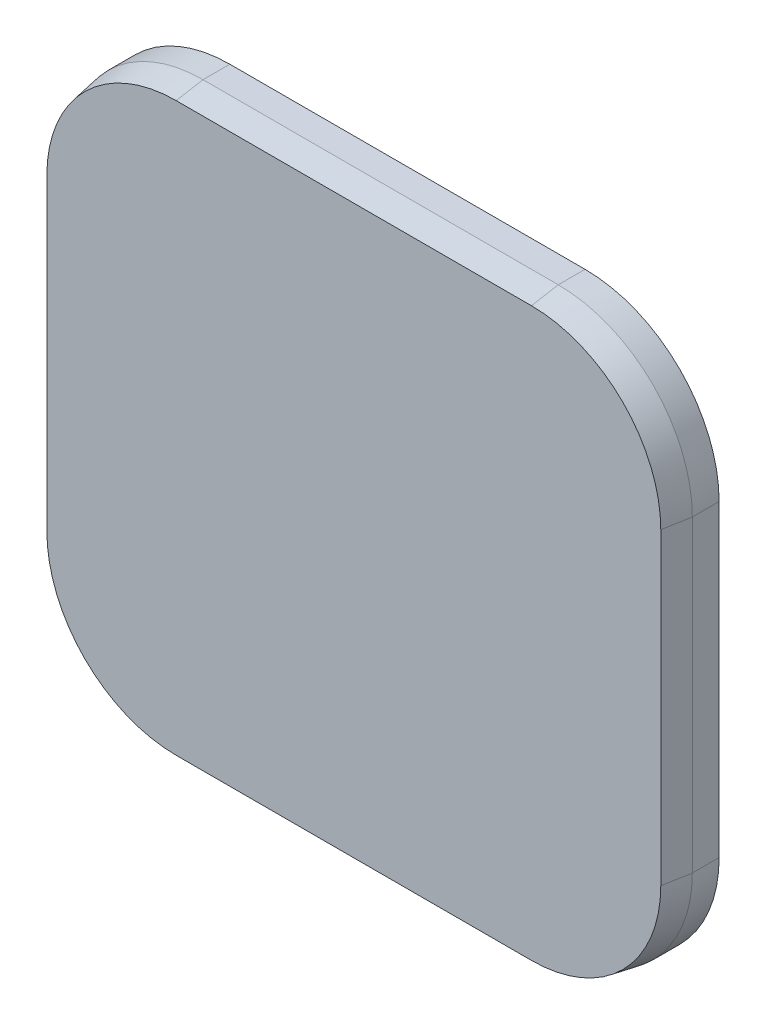
from build123d import *

# Parameters (mm, degrees)
RESSALTO_EXTRUS_O2_DEPTH           = 2
RESSALTO_EXTRUS_O2_OTHER_WAY_DEPTH = 2
RESSALTO_EXTRUS_O2_OTHER_WAY_TAPER = 10


with BuildPart() as part:
    # Esboço6 → Ressalto-extrusão2 (new body)
    with BuildSketch(Plane.XY):
        with BuildLine():
            ThreePointArc((-10, 0), (-2.928932188, 2.928932188), (0, 10))
            Line((0, 10), (0, 33))
            ThreePointArc((0, 33), (-2.928932188, 40.071067812), (-10, 43))
            Line((-10, 43), (-36.5, 43))
            ThreePointArc((-36.5, 43), (-43.571067812, 40.071067812), (-46.5, 33))
            Line((-46.5, 33), (-46.5, 10))
            ThreePointArc((-46.5, 10), (-43.571067812, 2.928932188), (-36.5, 0))
            Line((-36.5, 0), (-10, 0))
        make_face()
    extrude(amount=-RESSALTO_EXTRUS_O2_DEPTH)

    # Esboço6 → Ressalto-extrusão2 other way (add)
    with BuildSketch(Plane.XY):
        with BuildLine():
            ThreePointArc((-10, 0), (-2.928932188, 2.928932188), (0, 10))
            Line((0, 10), (0, 33))
            ThreePointArc((0, 33), (-2.928932188, 40.071067812), (-10, 43))
            Line((-10, 43), (-36.5, 43))
            ThreePointArc((-36.5, 43), (-43.571067812, 40.071067812), (-46.5, 33))
            Line((-46.5, 33), (-46.5, 10))
            ThreePointArc((-46.5, 10), (-43.571067812, 2.928932188), (-36.5, 0))
            Line((-36.5, 0), (-10, 0))
        make_face()
    extrude(amount=RESSALTO_EXTRUS_O2_OTHER_WAY_DEPTH, taper=RESSALTO_EXTRUS_O2_OTHER_WAY_TAPER)


solid = part.part
